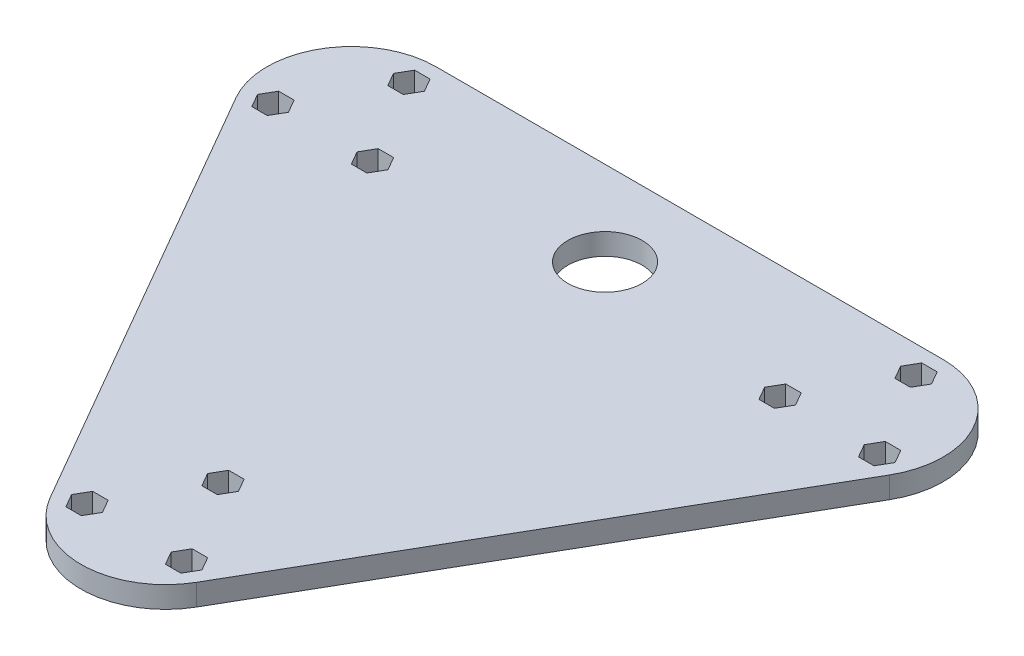
from build123d import *

# Parameters (mm, degrees)
ESQUISSE1_R             = 11
BOSS_EXTRU_1_DEPTH      = 6.35
ENL_V_MAT_EXTRU_1_DEPTH = 135.686014493


with BuildPart() as part:
    # Esquisse1 → Boss.-Extru.1 (new body)
    with BuildSketch(Plane(origin=(0, 0, 0), x_dir=(1, 0, 0), z_dir=(0, 1, 0))):
        with BuildLine():
            Line((-96.654639651, 52.506938663), (-21.654639651, -77.493061337))
            ThreePointArc((-21.654639651, -77.493061337), (0, -90), (21.654639651, -77.493061337))
            Line((21.654639651, -77.493061337), (96.654639651, 52.506938663))
            ThreePointArc((96.654639651, 52.506938663), (96.648631983, 77.50346885), (75, 90))
            Line((75, 90), (-75, 90))
            ThreePointArc((-75, 90), (-96.648631983, 77.50346885), (-96.654639651, 52.506938663))
        make_face()
        with Locations(Location((0, 65, 0), (0, 0, 270))):
            Circle(ESQUISSE1_R, mode=Mode.SUBTRACT)
    extrude(amount=BOSS_EXTRU_1_DEPTH)

    # Esquisse3 → Enlèv. mat.-Extru.1 (cut, through all)
    with BuildSketch(Plane.XZ):
        Polygon((-79.572614132, -82), (-77.286307066, -85.96), (-72.713692934, -85.96), (-70.427385868, -82), (-72.713692934, -78.04), (-77.286307066, -78.04), align=None)
        Polygon((-94.295045996, -56.5), (-92.00873893, -60.46), (-87.436124798, -60.46), (-85.149817732, -56.5), (-87.436124798, -52.54), (-92.00873893, -52.54), align=None)
        Polygon((-64.850182268, -56.5), (-62.563875202, -60.46), (-57.99126107, -60.46), (-55.704954004, -56.5), (-57.99126107, -52.54), (-62.563875202, -52.54), align=None)
        Polygon((55.704954004, -56.5), (57.99126107, -60.46), (62.563875202, -60.46), (64.850182268, -56.5), (62.563875202, -52.54), (57.99126107, -52.54), align=None)
        Polygon((70.427385868, -82), (72.713692934, -85.96), (77.286307066, -85.96), (79.572614132, -82), (77.286307066, -78.04), (72.713692934, -78.04), align=None)
        Polygon((85.149817732, -56.5), (87.436124798, -60.46), (92.00873893, -60.46), (94.295045996, -56.5), (92.00873893, -52.54), (87.436124798, -52.54), align=None)
        Polygon((-4.572614132, 48), (-2.286307066, 44.04), (2.286307066, 44.04), (4.572614132, 48), (2.286307066, 51.96), (-2.286307066, 51.96), align=None)
        Polygon((-19.295045996, 73.5), (-17.00873893, 69.54), (-12.436124798, 69.54), (-10.149817732, 73.5), (-12.436124798, 77.46), (-17.00873893, 77.46), align=None)
        Polygon((10.149817732, 73.5), (12.436124798, 69.54), (17.00873893, 69.54), (19.295045996, 73.5), (17.00873893, 77.46), (12.436124798, 77.46), align=None)
    extrude(amount=-ENL_V_MAT_EXTRU_1_DEPTH, mode=Mode.SUBTRACT)


solid = part.part
